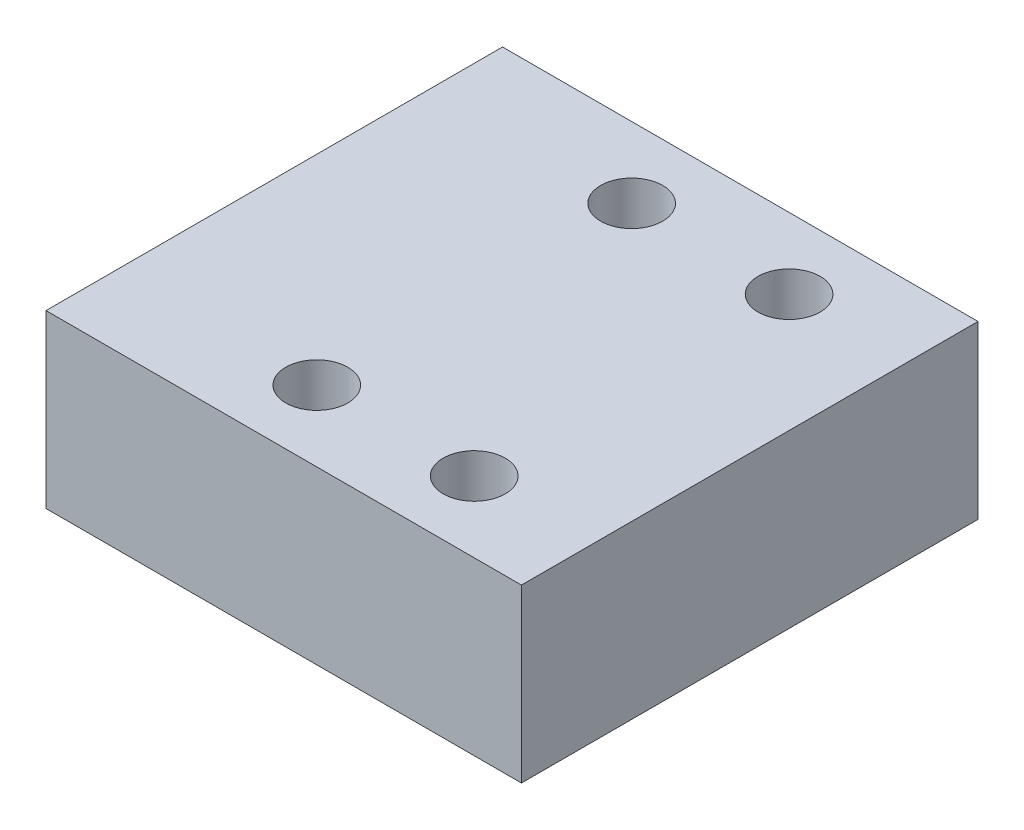
from build123d import *

# Parameters (mm, degrees)
SKETCH1_W           = 38.354
SKETCH1_H           = 36.83
SKETCH1_R           = 2.5019
BOSS_EXTRUDE1_DEPTH = 13.8303


with BuildPart() as part:
    # Sketch1 → Boss-Extrude1 (new body)
    with BuildSketch(Plane(origin=(0, 0, 0), x_dir=(1, 0, 0), z_dir=(0, 1, 0))):
        with Locations((-10.134843348, 4.07425912)):
            Rectangle(SKETCH1_W, SKETCH1_H)
        with Locations(Location((-0.482843348, 16.77425912, 0), (0, 0, 90))):
            Circle(SKETCH1_R, mode=Mode.SUBTRACT)
        with Locations(Location((-13.182843348, 16.77425912, 0), (0, 0, 90))):
            Circle(SKETCH1_R, mode=Mode.SUBTRACT)
        with Locations(Location((-0.482843348, -8.62574088, 0), (0, 0, 90))):
            Circle(SKETCH1_R, mode=Mode.SUBTRACT)
        with Locations(Location((-13.182843348, -8.62574088, 0), (0, 0, 90))):
            Circle(SKETCH1_R, mode=Mode.SUBTRACT)
    extrude(amount=BOSS_EXTRUDE1_DEPTH)


solid = part.part
